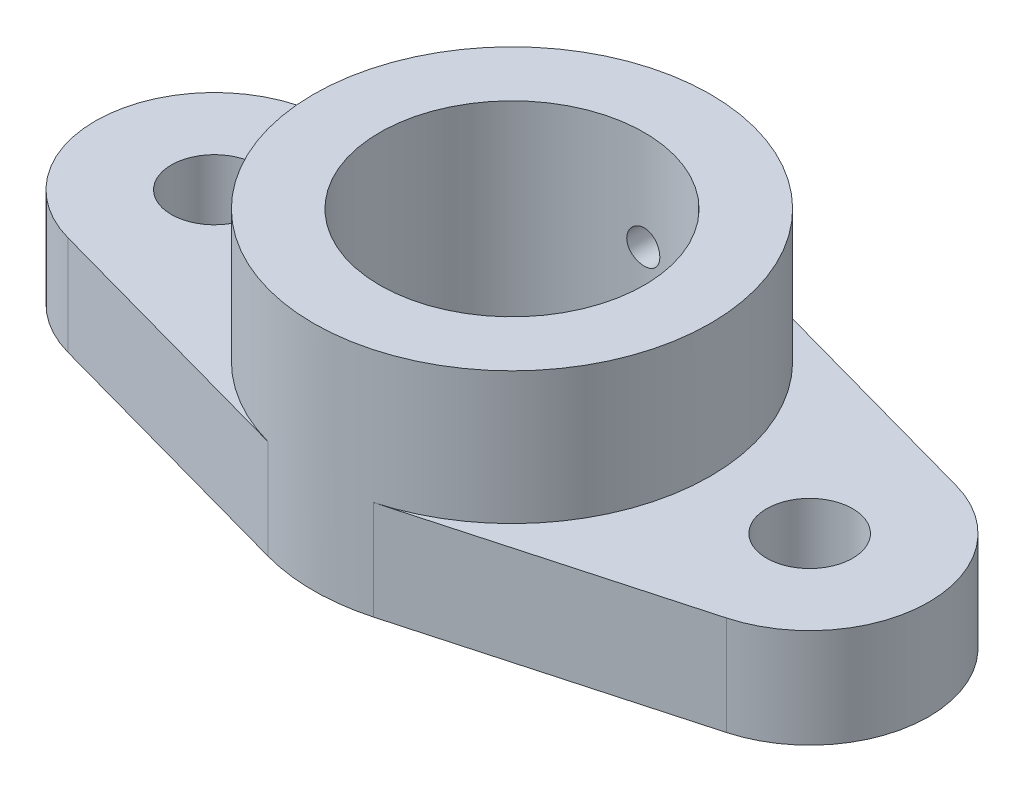
from build123d import *
from build123d.topology import SkipClean

# Parameters (mm, degrees)
IZIM1_R                     = 6.5
Y_KSEKLIK_EKSTR_ZYON2_DEPTH = 15
IZIM2_R                     = 30
Y_KSEKLIK_EKSTR_ZYON3_DEPTH = 20
IZIM3_R                     = 20
KES_EKSTR_ZYON2_DEPTH       = 83
IZIM4_R                     = 2.5
KES_EKSTR_ZYON3_DEPTH       = 15


with BuildPart() as part:
    # Çizim1 → Yükseklik-Ekstrüzyon2 (new body)
    with BuildSketch(Plane(origin=(0, 0, 0), x_dir=(1, 0, 0), z_dir=(0, 1, 0))):
        with BuildLine():
            Line((-49.8, 17.348198754), (-8, 28.91366459))
            ThreePointArc((-8, 28.91366459), (0, 30), (8, 28.91366459))
            Line((8, 28.91366459), (49.8, 17.348198754))
            ThreePointArc((49.8, 17.348198754), (63, 0), (49.8, -17.348198754))
            Line((49.8, -17.348198754), (8, -28.91366459))
            ThreePointArc((8, -28.91366459), (0, -30), (-8, -28.91366459))
            Line((-8, -28.91366459), (-49.8, -17.348198754))
            ThreePointArc((-49.8, -17.348198754), (-63, 0), (-49.8, 17.348198754))
        make_face()
        with Locations(Location((-45, 0, 0), (0, 0, 270))):
            Circle(IZIM1_R, mode=Mode.SUBTRACT)
        with Locations(Location((45, 0, 0), (0, 0, 90))):
            Circle(IZIM1_R, mode=Mode.SUBTRACT)
    extrude(amount=Y_KSEKLIK_EKSTR_ZYON2_DEPTH)

    # Çizim2 → Yükseklik-Ekstrüzyon3 (add)
    with SkipClean():  # the faces are left unmerged after this step: merging them gives an invalid solid
        with BuildSketch(Plane(origin=(0, 15, 0), x_dir=(1, 0, 0), z_dir=(0, 1, 0))):
            with Locations(Location((0, 0, 0), (0, 0, 105.466009953))):
                Circle(IZIM2_R)
        extrude(amount=Y_KSEKLIK_EKSTR_ZYON3_DEPTH)

    # Çizim3 → Kes-Ekstrüzyon2 (cut)
    with SkipClean():  # the faces are left unmerged after this step: merging them gives an invalid solid
        with BuildSketch(Plane(origin=(0, 35, 0), x_dir=(1, 0, 0), z_dir=(0, 1, 0))):
            with Locations(Location((0, 0, 0), (0, 0, 270))):
                Circle(IZIM3_R)
        extrude(amount=-KES_EKSTR_ZYON2_DEPTH, mode=Mode.SUBTRACT)

    # Çizim4 → Kes-Ekstrüzyon3 (cut)
    with BuildSketch(Plane(origin=(0, 0, -30), x_dir=(-1, 0, 0), z_dir=(0, 0, -1))):
        with Locations((0, 20)):
            Circle(IZIM4_R)
    extrude(amount=-KES_EKSTR_ZYON3_DEPTH, mode=Mode.SUBTRACT)


solid = part.part
